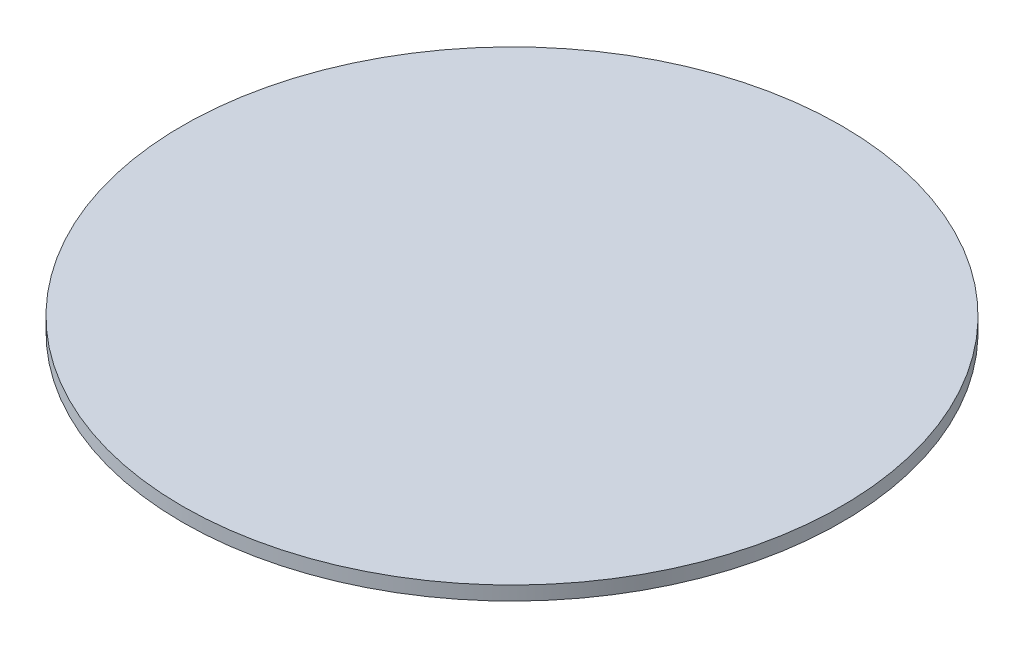
from build123d import *

# Parameters (mm, degrees)
SKETCH1_R           = 75.184
BOSS_EXTRUDE1_DEPTH = 3.175


with BuildPart() as part:
    # Sketch1 → Boss-Extrude1 (new body)
    with BuildSketch(Plane(origin=(0, 0, 0), x_dir=(1, 0, 0), z_dir=(0, 1, 0))):
        with Locations(Location((0, 0, 0), (0, 0, 270))):
            Circle(SKETCH1_R)
    extrude(amount=BOSS_EXTRUDE1_DEPTH)


solid = part.part
